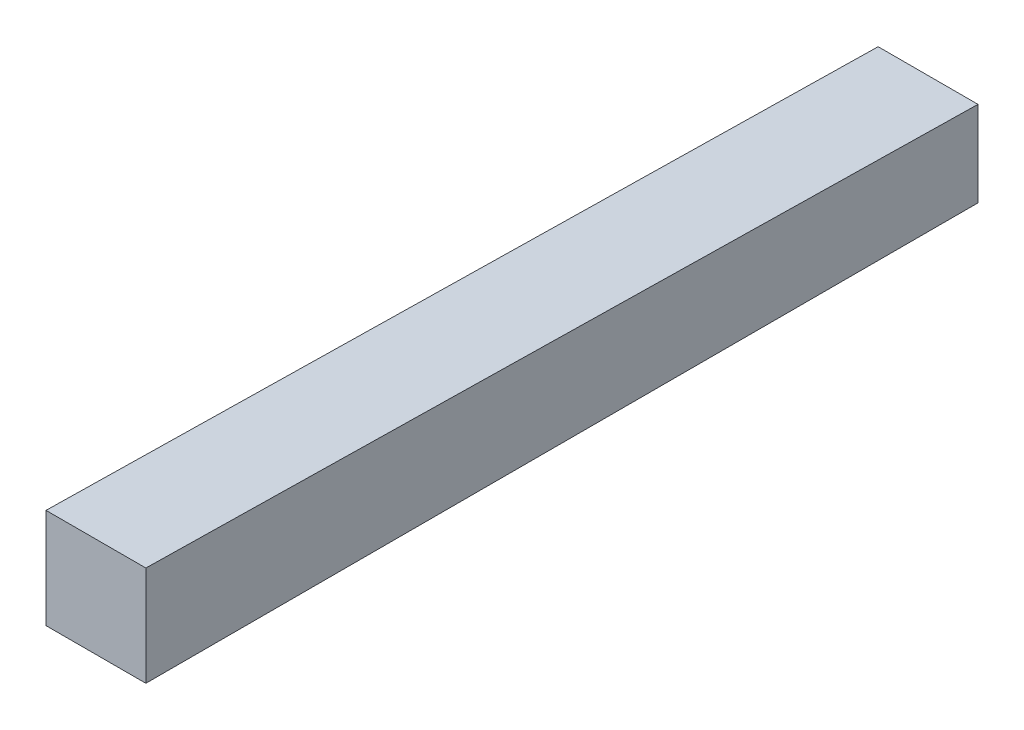
from build123d import *

# Parameters (mm, degrees)
SKETCH1_W           = 6
SKETCH1_H           = 6
BOSS_EXTRUDE1_DEPTH = 25
DRAFT2_ANGLE        = -1


with BuildPart() as part:
    # Sketch1 → Boss-Extrude1 (new, symmetric)
    with BuildSketch(Plane.XY):
        Rectangle(SKETCH1_W, SKETCH1_H)
    extrude(amount=BOSS_EXTRUDE1_DEPTH, both=True)

    # Draft2
    draft2_faces = [part.faces().sort_by_distance(p)[0] for p in [
        (0, 3, 0),
    ]]
    draft(draft2_faces, Plane.XY.offset(25), DRAFT2_ANGLE)


solid = part.part
